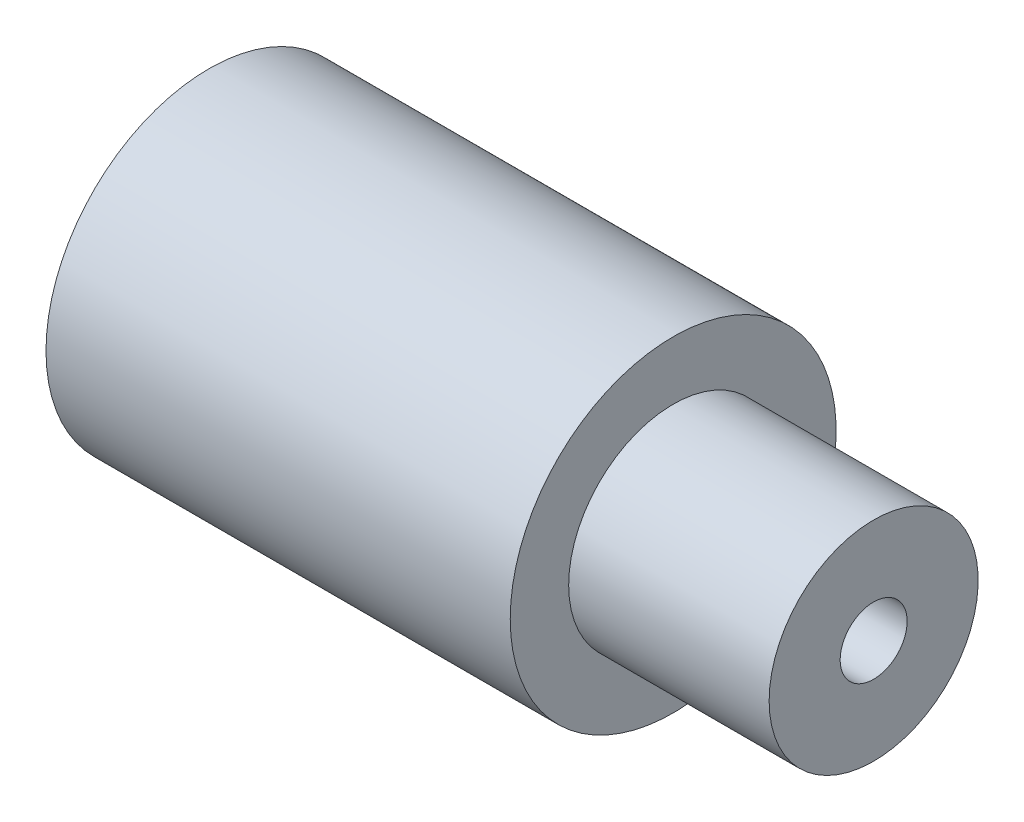
from build123d import *

# Parameters (mm, degrees)
SOCKET_SKETCH_W = 33.5
SOCKET_SKETCH_H = 1.5875


with BuildPart() as part:
    # Conn_T2_ORB4_Bored Sketch → Conn_T2_ORB4_Bored (revolve)
    with BuildSketch(Plane.XY):
        Polygon((9.5, 0), (9.5, 4.953), (0, 4.953), (0, 7.722), (-22, 7.722), (-22, 0), align=None)
    revolve(axis=Axis((-1000, 0, 0), (1, 0, 0)))

    # Socket Sketch → Socket (revolve, cut)
    with BuildSketch(Plane.XY):
        with Locations((-6.25, 0.79375)):
            Rectangle(SOCKET_SKETCH_W, SOCKET_SKETCH_H)
    revolve(axis=Axis((-1000, 0, 0), (1, 0, 0)), mode=Mode.SUBTRACT)


solid = part.part
